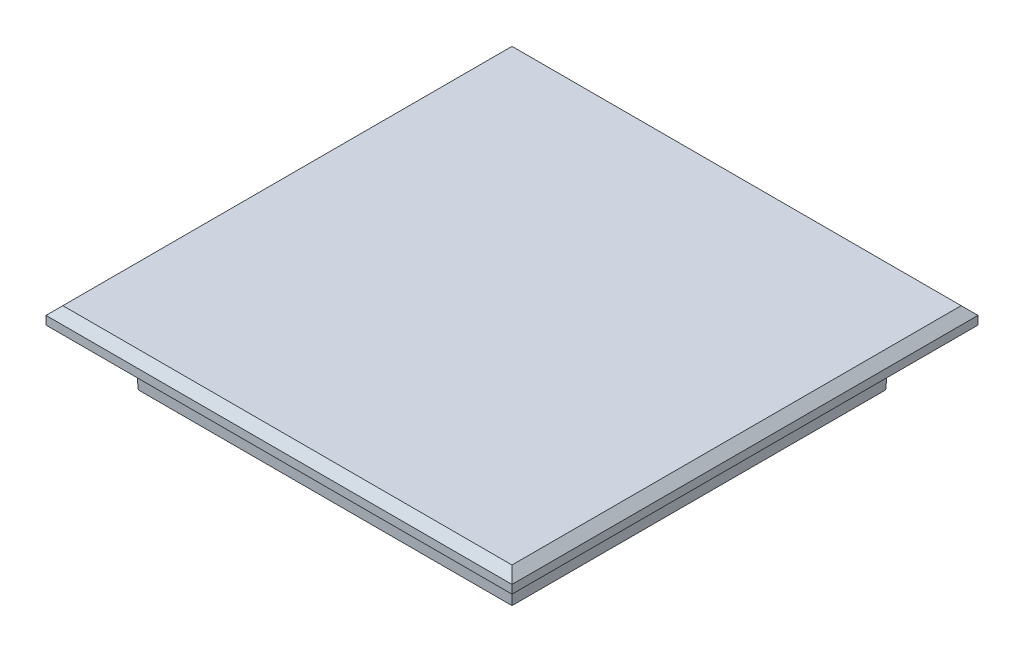
from build123d import *

# Parameters (mm, degrees)
SKETCH1_W             = 67.6
SKETCH1_H             = 67.6
SKETCH1_W_2           = 61.6
SKETCH1_H_2           = 61.6
BOSS_EXTRUDE1_DEPTH   = 10
BOSS_EXTRUDE1_DRAFT   = -3
SKETCH2_W             = 83
SKETCH2_H             = 83
BOSS_EXTRUDE2_DEPTH   = 3
CHAMFER1_SIZE         = 1.5
CHAMFER2_SIZE         = 2
CHAMFER2_SIZE2        = 2.113509005
CHAMFER2_EDGE_2_SIZE  = 2
CHAMFER2_EDGE_2_SIZE2 = 2.113509005
CHAMFER2_EDGE_3_SIZE  = 2
CHAMFER2_EDGE_3_SIZE2 = 2.113509005
CHAMFER2_EDGE_4_SIZE  = 2
CHAMFER2_EDGE_4_SIZE2 = 2.113509005


with BuildPart() as part:
    # Sketch1 → Boss-Extrude1 (with draft: the straight prism first)
    with BuildSketch(Plane(origin=(0, 0, 0), x_dir=(1, 0, 0), z_dir=(0, 1, 0))):
        Rectangle(SKETCH1_W, SKETCH1_H)
        Rectangle(SKETCH1_W_2, SKETCH1_H_2, mode=Mode.SUBTRACT)
    extrude(amount=-BOSS_EXTRUDE1_DEPTH)
    # Boss-Extrude1: the draft: its side faces are tilted about the plane it starts from
    boss_extrude1_sides = [part.faces().sort_by_distance(p)[0] for p in [
        (-33.8, -5, 0),
        (0, -5, 33.8),
        (33.8, -5, 0),
        (0, -5, -33.8),
        (0, -5, -30.8),
        (30.8, -5, 0),
        (0, -5, 30.8),
        (-30.8, -5, 0),
    ]]
    draft(boss_extrude1_sides, Plane(origin=(0, 0, 0), x_dir=(1, 0, 0), z_dir=(0, 1, 0)), BOSS_EXTRUDE1_DRAFT)

    # Sketch2 → Boss-Extrude2 (add)
    with BuildSketch(Plane(origin=(0, 0, 0), x_dir=(1, 0, 0), z_dir=(0, 1, 0))):
        Rectangle(SKETCH2_W, SKETCH2_H)
    extrude(amount=BOSS_EXTRUDE2_DEPTH)

    # Chamfer1
    chamfer1_edges = [part.edges().sort_by_distance(p)[0] for p in [
        (41.5, 3, 0),
        (0, 3, -41.5),
        (-41.5, 3, 0),
        (0, 3, 41.5),
    ]]
    chamfer(chamfer1_edges, length=CHAMFER1_SIZE)

    # Chamfer2
    chamfer2_edges = [part.edges().sort_by_distance(p)[0] for p in [
        (-30.8, 0, 0),
    ]]
    chamfer2_side = [part.faces().sort_by_distance(p)[0] for p in [
        (0, 0, 0),
    ]]
    chamfer(chamfer2_edges, length=CHAMFER2_SIZE, length2=CHAMFER2_SIZE2, reference=chamfer2_side[0])

    # Chamfer2 edge 2
    chamfer2_edge_2_edges = [part.edges().sort_by_distance(p)[0] for p in [
        (0, 0, 30.8),
    ]]
    chamfer2_edge_2_side = [part.faces().sort_by_distance(p)[0] for p in [
        (0, 0, 0),
    ]]
    chamfer(chamfer2_edge_2_edges, length=CHAMFER2_EDGE_2_SIZE, length2=CHAMFER2_EDGE_2_SIZE2, reference=chamfer2_edge_2_side[0])

    # Chamfer2 edge 3
    chamfer2_edge_3_edges = [part.edges().sort_by_distance(p)[0] for p in [
        (30.8, 0, 0),
    ]]
    chamfer2_edge_3_side = [part.faces().sort_by_distance(p)[0] for p in [
        (0, 0, 0),
    ]]
    chamfer(chamfer2_edge_3_edges, length=CHAMFER2_EDGE_3_SIZE, length2=CHAMFER2_EDGE_3_SIZE2, reference=chamfer2_edge_3_side[0])

    # Chamfer2 edge 4
    chamfer2_edge_4_edges = [part.edges().sort_by_distance(p)[0] for p in [
        (0, 0, -30.8),
    ]]
    chamfer2_edge_4_side = [part.faces().sort_by_distance(p)[0] for p in [
        (0, 0, 0),
    ]]
    chamfer(chamfer2_edge_4_edges, length=CHAMFER2_EDGE_4_SIZE, length2=CHAMFER2_EDGE_4_SIZE2, reference=chamfer2_edge_4_side[0])


solid = part.part
